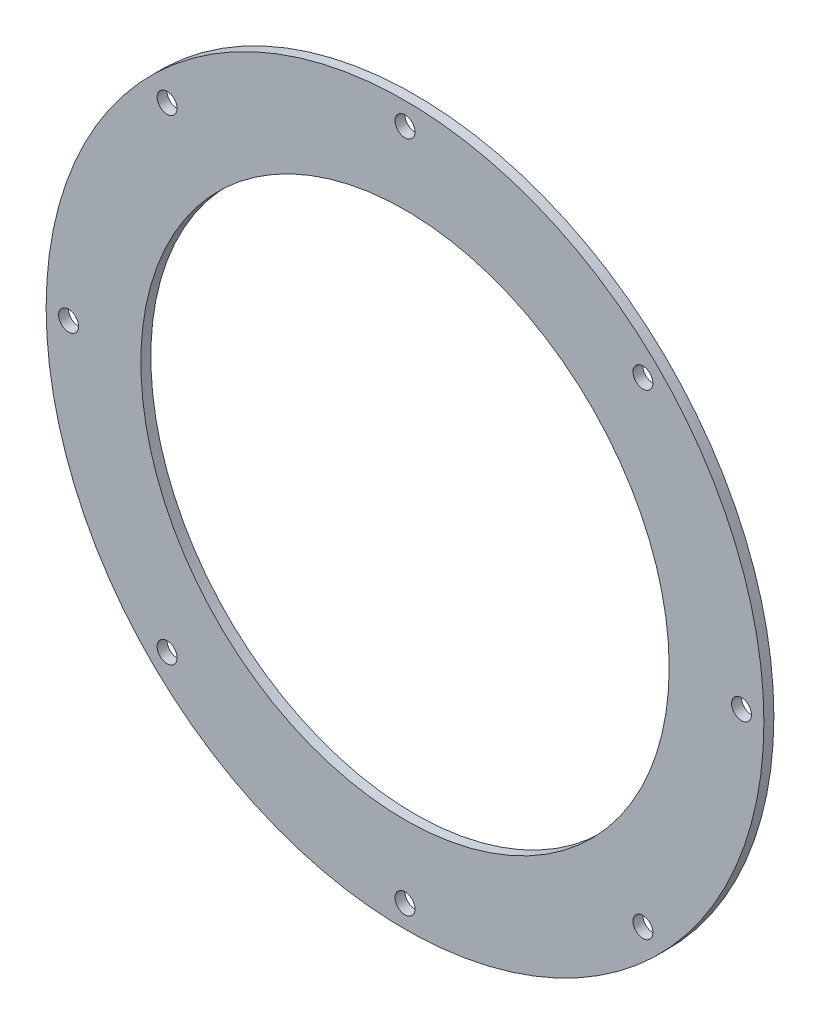
from build123d import *

# Parameters (mm, degrees)
SKETCH_1_R      = 72
SKETCH_1_R_2    = 2
SKETCH_1_R_3    = 53
EXTRUDE_1_DEPTH = 2


with BuildPart() as part:
    # 草图1 → 凸台-拉伸1 (new body)
    with BuildSketch(Plane.XY):
        Circle(SKETCH_1_R)
        with Locations((0, -67.5)):
            Circle(SKETCH_1_R_2, mode=Mode.SUBTRACT)
        with Locations((-47.72970773, -47.72970773)):
            Circle(SKETCH_1_R_2, mode=Mode.SUBTRACT)
        with Locations((-67.5, 0)):
            Circle(SKETCH_1_R_2, mode=Mode.SUBTRACT)
        with Locations((-47.72970773, 47.72970773)):
            Circle(SKETCH_1_R_2, mode=Mode.SUBTRACT)
        with Locations((0, 67.5)):
            Circle(SKETCH_1_R_2, mode=Mode.SUBTRACT)
        with Locations((47.72970773, 47.72970773)):
            Circle(SKETCH_1_R_2, mode=Mode.SUBTRACT)
        with Locations((67.5, 0)):
            Circle(SKETCH_1_R_2, mode=Mode.SUBTRACT)
        with Locations((47.72970773, -47.72970773)):
            Circle(SKETCH_1_R_2, mode=Mode.SUBTRACT)
        Circle(SKETCH_1_R_3, mode=Mode.SUBTRACT)
    extrude(amount=EXTRUDE_1_DEPTH)


solid = part.part
